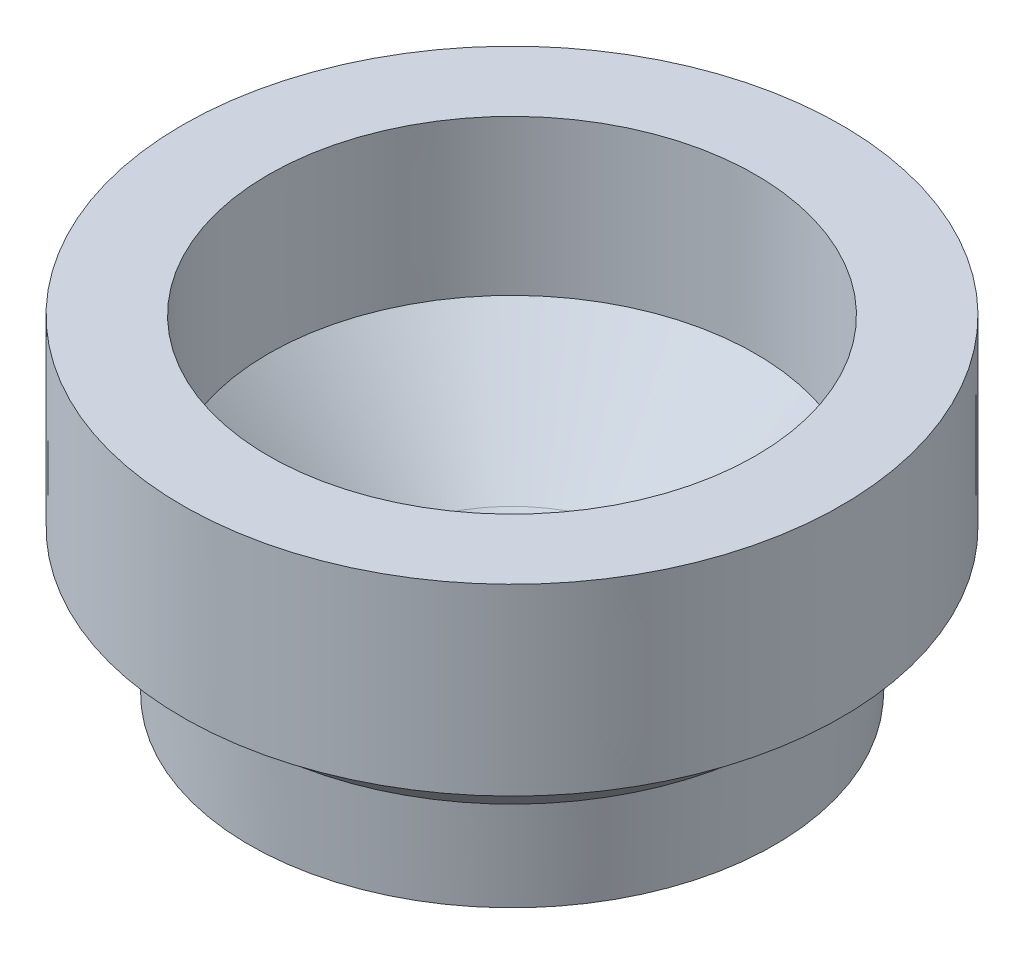
from build123d import *


with BuildPart() as part:
    # Çizim1 → Döndür1 (revolve)
    with BuildSketch(Plane.XY, mode=Mode.PRIVATE) as d_nd_r1_sk:
        with BuildLine():
            Line((0.000169209, 3.461128296), (0, 0))
            Line((0, 0), (10.218402158, 0))
            Line((10.218402158, 0), (12.190272224, 1.390446413))
            Line((12.190272224, 1.390446413), (12.390593979, 5.697403621))
            Line((12.390593979, 5.697403621), (15.025609693, 8.073507981))
            Line((15.025609693, 8.073507981), (15.294122949, 8.07362883))
            Line((15.294122949, 8.07362883), (15.294122949, 16.588509883))
            Line((15.294122949, 16.588509883), (11.306507295, 16.588509883))
            Line((11.306507295, 16.588509883), (11.306507295, 9.392295548))
            Line((11.306507295, 9.392295548), (6.466218888, 4.336313055))
            ThreePointArc((6.466218888, 4.336313055), (5.591548834, 3.689343395), (4.527812347, 3.461128296))
            Line((4.527812347, 3.461128296), (0.000169209, 3.461128296))
        make_face()
    revolve(d_nd_r1_sk.sketch.rotate(Axis((0.000169209, 3.461128296, 0), (-4.888832334792135e-05, -0.9999999988049659, 0)), 180), axis=Axis((0.000169209, 3.461128296, 0), (-4.888832334792135e-05, -0.9999999988049659, 0)))


solid = part.part
